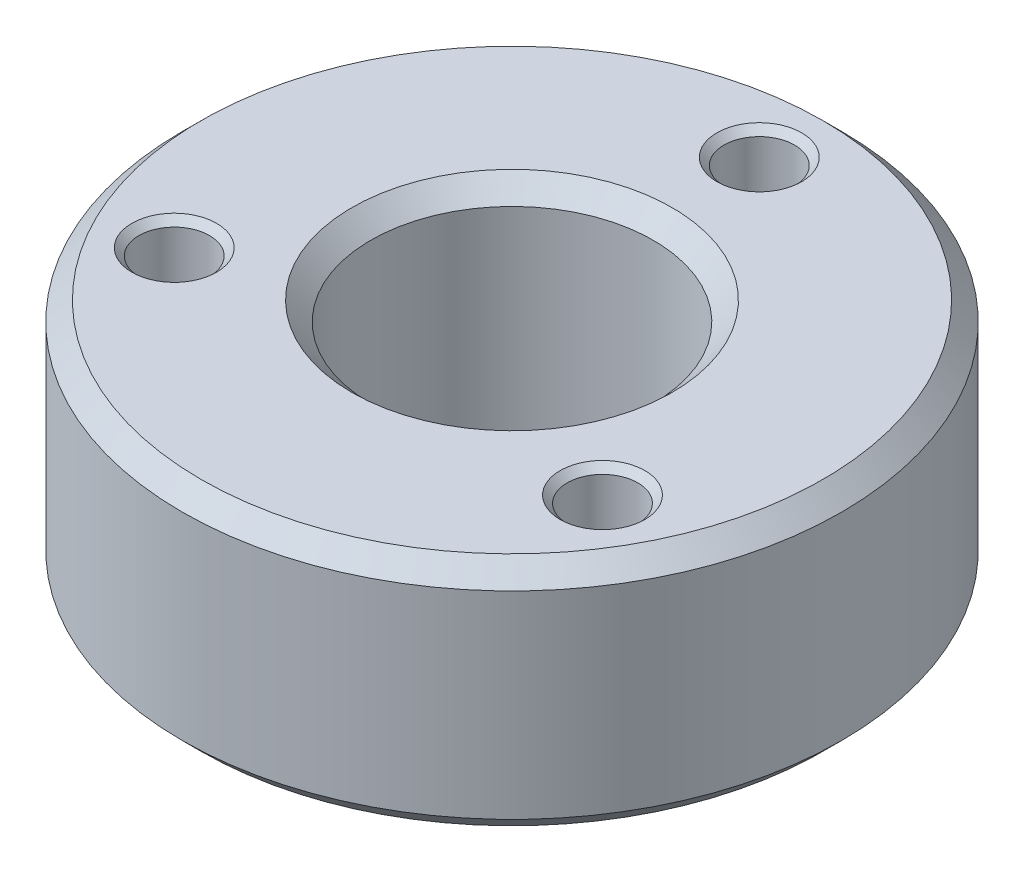
from build123d import *

# Parameters (mm, degrees)
SKETCH1_R                    = 14
BOSS_EXTRUDE1_DEPTH          = 10
SKETCH2_R                    = 6
CUT_EXTRUDE1_DEPTH           = 23.181073013
SKETCH3_R                    = 1.5
CUT_EXTRUDE2_DEPTH           = 23.181073013
CHAMFER1_SIZE                = 0.8
CHAMFER2_SIZE                = 0.3
CIRPATTERN1_COUNT            = 3
CHAMFER2_OF_CIRPATTERN1_SIZE = 0.3


with BuildPart() as part:
    # Sketch1 → Boss-Extrude1 (new body)
    with BuildSketch(Plane(origin=(0, 0, 0), x_dir=(1, 0, 0), z_dir=(0, 1, 0))):
        with Locations(Location((0, 0, 0), (0, 0, 270))):
            Circle(SKETCH1_R)
    extrude(amount=BOSS_EXTRUDE1_DEPTH)

    # Sketch2 → Cut-Extrude1 (cut, through all)
    with BuildSketch(Plane(origin=(0, 10, 0), x_dir=(1, 0, 0), z_dir=(0, 1, 0))):
        with Locations(Location((0, 0, 0), (0, 0, 270))):
            Circle(SKETCH2_R)
    extrude(amount=-CUT_EXTRUDE1_DEPTH, mode=Mode.SUBTRACT)

    # Sketch3 → Cut-Extrude2 (cut, through all)
    with BuildSketch(Plane(origin=(0, 10, 0), x_dir=(1, 0, 0), z_dir=(0, 1, 0))):
        with Locations(Location((0, 10.5, 0), (0, 0, 270))):
            Circle(SKETCH3_R)
    cut_extrude2 = extrude(amount=-CUT_EXTRUDE2_DEPTH, mode=Mode.SUBTRACT)

    # Chamfer1
    chamfer1_edges = [part.edges().sort_by_distance(p)[0] for p in [
        (0, 0, -14),
        (0, 10, -14),
        (0, 0, -6),
        (0, 10, -6),
    ]]
    chamfer(chamfer1_edges, length=CHAMFER1_SIZE)

    # Chamfer2
    chamfer2_edges = [part.edges().sort_by_distance(p)[0] for p in [
        (0, 0, -12),
        (0, 10, -12),
    ]]
    chamfer(chamfer2_edges, length=CHAMFER2_SIZE)

    # CirPattern1: Cut-Extrude2 ×3 about axis
    cirpattern1_axis = Axis((0, 0, 0), (0, 1, 0))
    for i in range(1, CIRPATTERN1_COUNT):
        add(cut_extrude2.rotate(cirpattern1_axis, i * 360 / CIRPATTERN1_COUNT), mode=Mode.SUBTRACT)

    # Chamfer2 of CirPattern1
    chamfer2_of_cirpattern1_edges = [part.edges().sort_by_distance(p)[0] for p in [
        (-10.392304845, 0, 6),
        (-10.392304845, 10, 6),
        (10.392304845, 0, 6),
        (10.392304845, 10, 6),
    ]]
    chamfer(chamfer2_of_cirpattern1_edges, length=CHAMFER2_OF_CIRPATTERN1_SIZE)


solid = part.part
